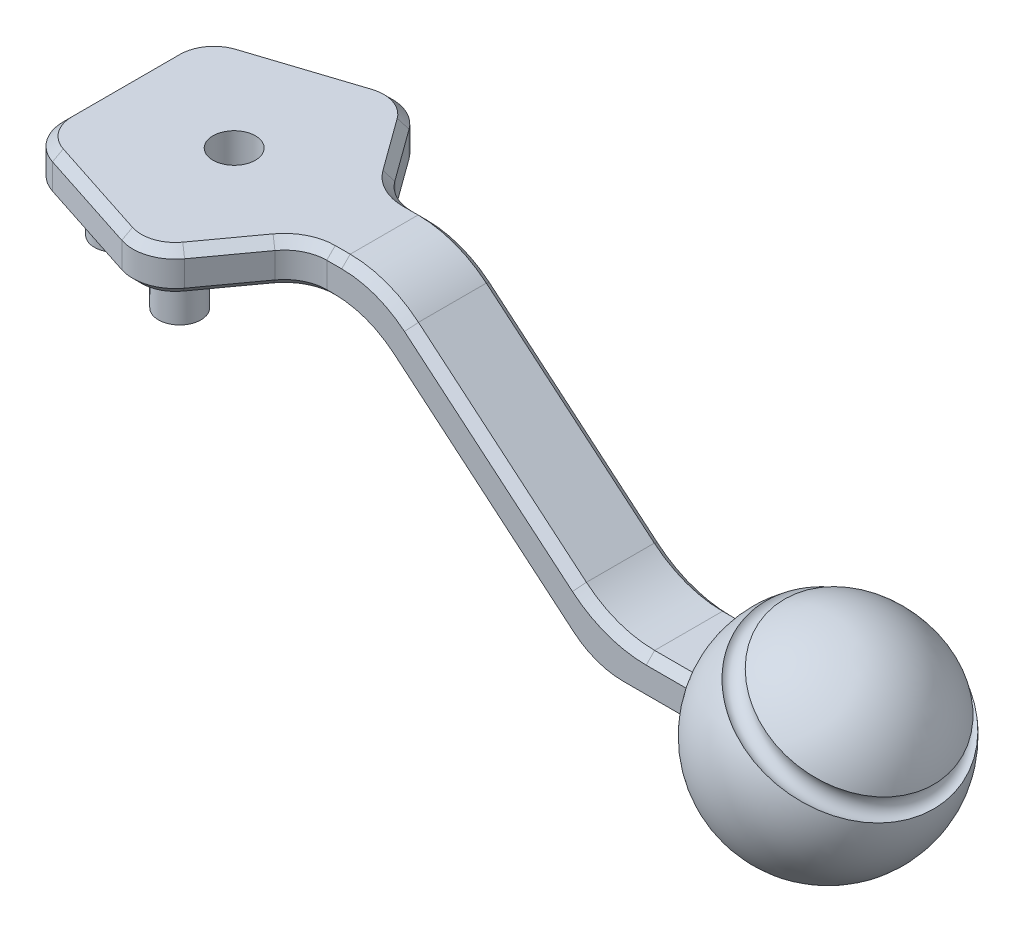
from build123d import *

# Parameters (mm, degrees)
BOSS_EXTRUDE4_DEPTH = 12.7
FILLET5_R           = 31.75
FILLET6_R           = 25.4
BOSS_EXTRUDE5_START = 63.5
BOSS_EXTRUDE5_DEPTH = 12.7
SKETCH20_R          = 6.35
CUT_EXTRUDE6_DEPTH  = 112.014
FILLET7_R           = 12.7
CHAMFER2_SIZE       = 2.54
BOSS_EXTRUDE7_START = 50.8
SKETCH22_R          = 6.35
BOSS_EXTRUDE7_DEPTH = 12.7
SKETCH23_R          = 3.175


with BuildPart() as part:
    # Sketch2 → Revolve1 (revolve)
    with BuildSketch(Plane.XY):
        with BuildLine():
            Line((0, 31.75), (0, 0))
            Line((0, 0), (0, -31.75))
            ThreePointArc((0, -31.75), (31.75, 0), (0, 31.75))
        make_face()
    revolve(axis=Axis((0, 31.75, 0), (0, -1, 0)))

    # Sketch15 → Boss-Extrude4 (add, symmetric)
    with BuildSketch(Plane.XY):
        Polygon((0, 0), (0, 6.35), (-53.34, 6.35), (-121.3358, 63.5), (-190.5, 63.5), (-190.5, 50.8), (-125.964099177, 50.8), (-57.968299177, -6.35), (-10.998522628, -6.35), (0, -6.35), align=None)
    extrude(amount=BOSS_EXTRUDE4_DEPTH, both=True)

    # Fillet5
    fillet5_edges = [part.edges().sort_by_distance(p)[0] for p in [
        (-53.34, 6.35, 0),
        (-121.3358, 63.5, 0),
    ]]
    fillet(fillet5_edges, radius=FILLET5_R)

    # Fillet6
    fillet6_edges = [part.edges().sort_by_distance(p)[0] for p in [
        (-125.964099177, 50.8, 0),
        (-57.968299177, -6.35, 0),
    ]]
    fillet(fillet6_edges, radius=FILLET6_R)

    # Sketch19 → Boss-Extrude5 (add)
    with BuildSketch(Plane(origin=(0, 0, 0), x_dir=(1, 0, 0), z_dir=(0, 1, 0)).offset(BOSS_EXTRUDE5_START)):
        Polygon((-134.630325886, 0), (-164.459837057, 41.056799873), (-212.725, 25.374497791), (-212.725, -25.374497791), (-164.459837057, -41.056799873), align=None)
    extrude(amount=-BOSS_EXTRUDE5_DEPTH)

    # Sketch20 → Cut-Extrude6 (cut)
    with BuildSketch(Plane(origin=(0, 0, 0), x_dir=(1, 0, 0), z_dir=(0, 1, 0))):
        with Locations(Location((-177.8, 0, 0), (0, 0, 90))):
            Circle(SKETCH20_R)
    extrude(amount=CUT_EXTRUDE6_DEPTH, mode=Mode.SUBTRACT)

    # Fillet7
    fillet7_edges = [part.edges().sort_by_distance(p)[0] for p in [
        (-164.459837057, 57.15, -41.056799873),
        (-143.857415991, 57.15, 12.7),
        (-164.459837057, 57.15, 41.056799873),
        (-212.725, 57.15, 25.374497791),
        (-212.725, 57.15, -25.374497791),
        (-143.857415991, 57.15, -12.7),
    ]]
    fillet(fillet7_edges, radius=FILLET7_R)

    # Chamfer2
    chamfer2_edges = [part.edges().sort_by_distance(p)[0] for p in [
        (-153.348624091, 63.5, 25.763527232),
        (-188.592418529, 63.5, -33.215648832),
        (-212.725, 63.5, 0),
        (-188.592418529, 63.5, 33.215648832),
        (-165.386289571, 63.5, 38.205472221),
        (-210.299515829, 63.5, 23.612280389),
        (-210.299515829, 63.5, -23.612280389),
        (-165.386289571, 63.5, -38.205472221),
        (-188.592418529, 50.8, -33.215648832),
        (-136.303570156, 50.8, 12.7),
        (-153.348624091, 50.8, 25.763527232),
        (-188.592418529, 50.8, 33.215648832),
        (-212.725, 50.8, 0),
        (-165.386289571, 50.8, 38.205472221),
        (-210.299515829, 50.8, 23.612280389),
        (-210.299515829, 50.8, -23.612280389),
        (-165.386289571, 50.8, -38.205472221),
        (-35.083657686, 6.35, -12.7),
        (-143.15212213, 63.5, -14.084217143),
        (-143.15212213, 50.8, -14.084217143),
        (-143.15212213, 63.5, 14.084217143),
        (-143.15212213, 50.8, 14.084217143),
        (-35.083657686, 6.35, 12.7),
        (-135.146495362, 63.5, -12.7),
        (-135.146495362, 63.5, 12.7),
        (-87.3379, 34.925, -12.7),
        (-122.035219306, 61.580801426, -12.7),
        (-87.3379, 34.925, 12.7),
        (-122.035219306, 61.580801426, 12.7),
        (-52.640580694, 8.269198574, -12.7),
        (-52.640580694, 8.269198574, 12.7),
        (-91.966199177, 22.225, -12.7),
        (-91.966199177, 22.225, 12.7),
        (-38.554882069, -6.35, -12.7),
        (-38.554882069, -6.35, 12.7),
        (-57.408763732, -4.81464114, -12.7),
        (-57.408763732, -4.81464114, 12.7),
        (-126.523634621, 49.26464114, -12.7),
        (-126.523634621, 49.26464114, 12.7),
        (-136.303570156, 50.8, -12.7),
        (-153.348624091, 50.8, -25.763527232),
        (-153.348624091, 63.5, -25.763527232),
    ]]
    chamfer(chamfer2_edges, length=CHAMFER2_SIZE)

    # Sketch22 → Boss-Extrude7 (add)
    with BuildSketch(Plane(origin=(0, 0, 0), x_dir=(1, 0, 0), z_dir=(0, 1, 0)).offset(BOSS_EXTRUDE7_START)):
        with Locations(Location((-198.349031657, -14.929745408, 0), (0, 0, 180))):
            Circle(SKETCH22_R)
        with Locations(Location((-198.349031657, 14.929745408, 0), (0, 0, 180))):
            Circle(SKETCH22_R)
        with Locations(Location((-169.950968343, 24.156835514, 0), (0, 0, 180))):
            Circle(SKETCH22_R)
        with Locations(Location((-169.950968343, -24.156835514, 0), (0, 0, 180))):
            Circle(SKETCH22_R)
    extrude(amount=-BOSS_EXTRUDE7_DEPTH)

    # Sketch23 → Cut-Revolve12 (revolve, cut)
    with BuildSketch(Plane.XY):
        with Locations((-15.875, 27.49630657)):
            Circle(SKETCH23_R)
    revolve(axis=Axis((0, 0, 0), (0.5000000000000011, 0.866025403784438, 0)), mode=Mode.SUBTRACT)


solid = part.part
